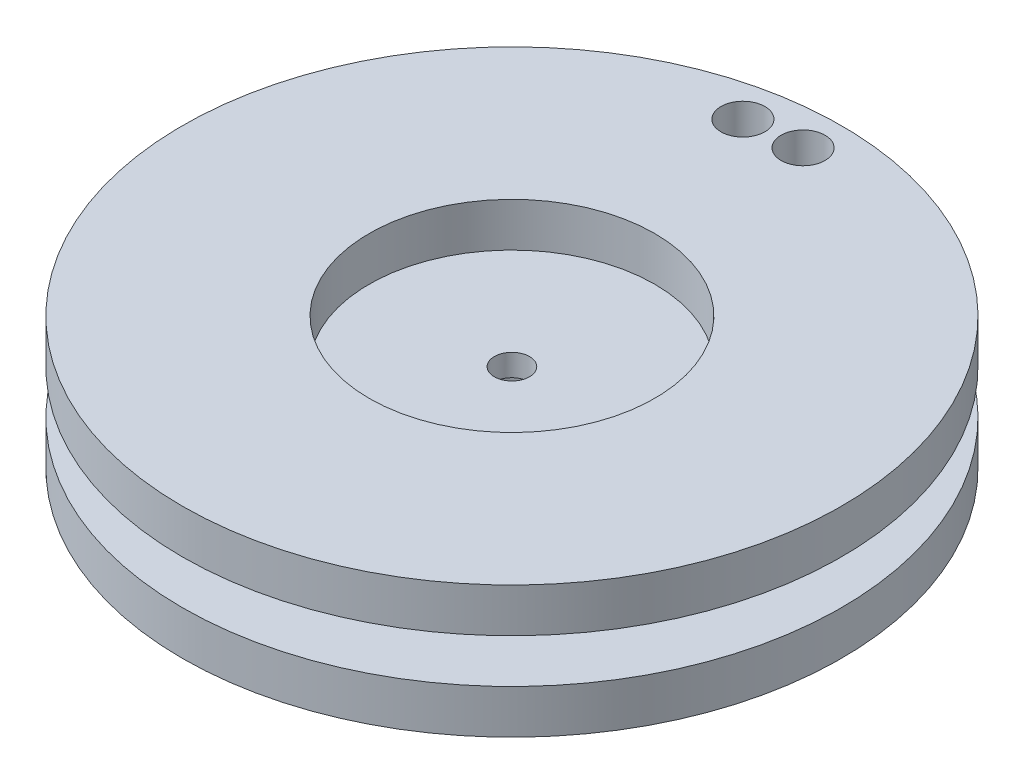
from build123d import *

# Parameters (mm, degrees)
SKETCH1_R           = 15
BOSS_EXTRUDE1_DEPTH = 2
SKETCH2_R           = 12
BOSS_EXTRUDE2_DEPTH = 2
SKETCH3_R           = 15
BOSS_EXTRUDE3_DEPTH = 2
SKETCH6_R           = 2.5
CUT_EXTRUDE5_DEPTH  = 3
SKETCH4_R           = 6.5
CUT_EXTRUDE6_DEPTH  = 2
SKETCH10_R          = 0.8
CUT_EXTRUDE7_DEPTH  = 22.587033145
SKETCH11_R          = 1
CUT_EXTRUDE8_DEPTH  = 23.045407685


with BuildPart() as part:
    # Sketch1 → Boss-Extrude1 (new body)
    with BuildSketch(Plane(origin=(0, 0, 0), x_dir=(1, 0, 0), z_dir=(0, 1, 0))):
        with Locations(Location((0, 0, 0), (0, 0, 270))):
            Circle(SKETCH1_R)
    extrude(amount=BOSS_EXTRUDE1_DEPTH)

    # Sketch2 → Boss-Extrude2 (add)
    with BuildSketch(Plane(origin=(0, 2, 0), x_dir=(1, 0, 0), z_dir=(0, 1, 0))):
        with Locations(Location((0, 0, 0), (0, 0, 270))):
            Circle(SKETCH2_R)
    extrude(amount=BOSS_EXTRUDE2_DEPTH)

    # Sketch3 → Boss-Extrude3 (add)
    with BuildSketch(Plane(origin=(0, 4, 0), x_dir=(1, 0, 0), z_dir=(0, 1, 0))):
        with Locations(Location((0, 0, 0), (0, 0, 270))):
            Circle(SKETCH3_R)
    extrude(amount=BOSS_EXTRUDE3_DEPTH)

    # Sketch6 → Cut-Extrude5 (cut)
    with BuildSketch(Plane.XZ):
        with Locations(Location((0, 0, 0), (0, 0, 270))):
            Circle(SKETCH6_R)
    extrude(amount=-CUT_EXTRUDE5_DEPTH, mode=Mode.SUBTRACT)

    # Sketch4 → Cut-Extrude6 (cut)
    with BuildSketch(Plane(origin=(0, 6, 0), x_dir=(1, 0, 0), z_dir=(0, 1, 0))):
        with Locations(Location((0, 0, 0), (0, 0, 270))):
            Circle(SKETCH4_R)
    extrude(amount=-CUT_EXTRUDE6_DEPTH, mode=Mode.SUBTRACT)

    # Sketch10 → Cut-Extrude7 (cut, through all)
    with BuildSketch(Plane(origin=(0, 4, 0), x_dir=(1, 0, 0), z_dir=(0, 1, 0))):
        with Locations(Location((0, 0, 0), (0, 0, 270))):
            Circle(SKETCH10_R)
    extrude(amount=-CUT_EXTRUDE7_DEPTH, mode=Mode.SUBTRACT)

    # Sketch11 → Cut-Extrude8 (cut, through all)
    with BuildSketch(Plane(origin=(0, 6, 0), x_dir=(1, 0, 0), z_dir=(0, 1, 0))):
        with Locations(Location((0, 13.25, 0), (0, 0, 270))):
            Circle(SKETCH11_R)
        with Locations(Location((-2.5, 13.01201368, 0), (0, 0, 270))):
            Circle(SKETCH11_R)
    extrude(amount=-CUT_EXTRUDE8_DEPTH, mode=Mode.SUBTRACT)


solid = part.part
